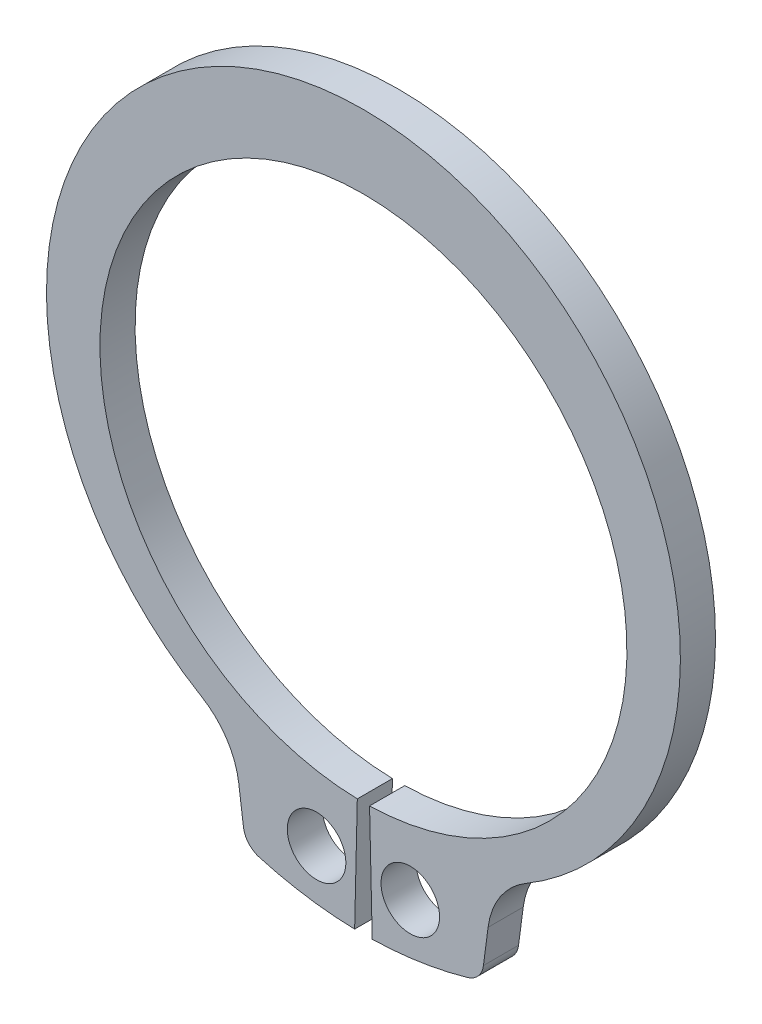
from build123d import *

# Parameters (mm, degrees)
BODYSKE_R  = 1
BODY_DEPTH = 1.2


with BuildPart() as part:
    # BodySke → Body (new body)
    with BuildSketch(Plane.XY):
        with BuildLine():
            Line((0.209302326, -8.997565923), (0.3, -12.896511156))
            ThreePointArc((0.3, -12.896511156), (1.946887524, -12.752240155), (3.561800129, -12.398531358))
            ThreePointArc((3.561800129, -12.398531358), (3.923012442, -12.167117051), (4.098302372, -11.775581156))
            Line((4.098302372, -11.775581156), (4.257820206, -10.563922915))
            ThreePointArc((4.257820206, -10.563922915), (4.672334321, -9.451967559), (5.530758278, -8.632592812))
            ThreePointArc((5.530758278, -8.632592812), (0, 11.5), (-5.530758278, -8.632592812))
            ThreePointArc((-5.530758278, -8.632592812), (-4.672334321, -9.451967559), (-4.257820206, -10.563922915))
            Line((-4.257820206, -10.563922915), (-4.098302372, -11.775581156))
            ThreePointArc((-4.098302372, -11.775581156), (-3.923012442, -12.167117051), (-3.561800129, -12.398531358))
            ThreePointArc((-3.561800129, -12.398531358), (-1.946887524, -12.752240155), (-0.3, -12.896511156))
            Line((-0.3, -12.896511156), (-0.209302326, -8.997565923))
            ThreePointArc((-0.209302326, -8.997565923), (0, 9), (0.209302326, -8.997565923))
        make_face()
        with Locations((1.6, -11.085125168)):
            Circle(BODYSKE_R, mode=Mode.SUBTRACT)
        with Locations((-1.6, -11.085125168)):
            Circle(BODYSKE_R, mode=Mode.SUBTRACT)
    extrude(amount=-BODY_DEPTH)


solid = part.part
